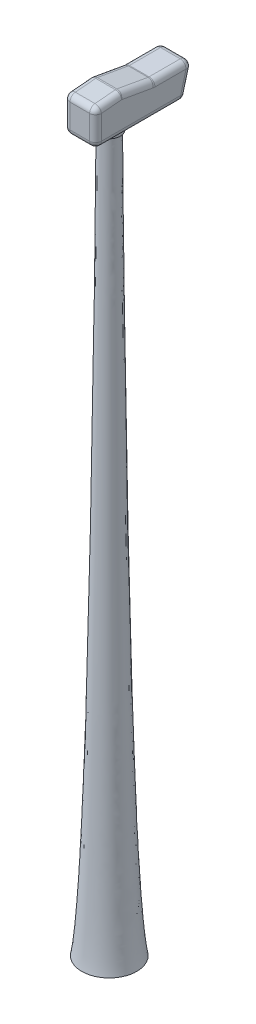
from build123d import *

# Parameters (mm, degrees)
AUFSATZ_LINEAR_AUSTRAGEN1_DEPTH      = 3840
AUFSATZ_LINEAR_AUSTRAGEN1_DEPTH_BACK = 3840
VERRUNDUNG1_R                        = 1440


with BuildPart() as part:
    # Skizze2 → Aufsatz-Linear austragen1 (new, two sides: drawn at the far end of the back side and taken through both)
    with BuildSketch(Plane(origin=(0, 0, 0), x_dir=(0, 0, -1), z_dir=(1, 0, 0)).offset(-AUFSATZ_LINEAR_AUSTRAGEN1_DEPTH_BACK)):
        Polygon((2800, -4320), (2800, 4320), (9280, 4886.926539648), (17200, 3490.416852437), (26800, 3490.416852437), (24707.205111839, -4320), align=None)
    extrude(amount=AUFSATZ_LINEAR_AUSTRAGEN1_DEPTH + AUFSATZ_LINEAR_AUSTRAGEN1_DEPTH_BACK)

    # Verrundung1
    verrundung1_edges = [part.edges().sort_by_distance(p)[0] for p in [
        (-3840, -414.791573782, -25753.60255592),
        (-3840, -4320, -13753.60255592),
        (0, -4320, -24707.205111839),
        (-3840, 3490.416852437, -22000),
        (0, 3490.416852437, -26800),
        (-3840, 4188.671696042, -13240),
        (0, 3490.416852437, -17200),
        (3840, 4188.671696042, -13240),
        (3840, 3490.416852437, -22000),
        (3840, -414.791573782, -25753.60255592),
        (3840, -4320, -13753.60255592),
        (-3840, 4603.463269824, -6040),
        (0, 4886.926539648, -9280),
        (3840, 4603.463269824, -6040),
        (-3840, 0, -2800),
        (0, 4320, -2800),
        (3840, 0, -2800),
        (0, -4320, -2800),
    ]]
    fillet(verrundung1_edges, radius=VERRUNDUNG1_R)

    # Skizze3 → Rotation1 (revolve)
    with BuildSketch(Plane(origin=(0, 0, 0), x_dir=(0, 0, -1), z_dir=(1, 0, 0))):
        with BuildLine():
            Line((10000, -2880), (7312, -2880))
            Line((7312, -2880), (7312, -5280))
            Line((7312, -5280), (7552, -5280))
            Line((7552, -5280), (7552, -4320))
            Line((7552, -4320), (7696, -4320))
            Line((7696, -4320), (7696, -5280))
            add(Edge.make_bspline(
                [(7696, -5280), (7696, -6007.773618817), (6760.658542043, -162191.98919373), (3280, -180000)],
                knots=[0, 0, 0, 0, 1, 1, 1, 1], degree=3))
            Line((3280, -180000), (10000, -180000))
            Line((10000, -180000), (10000, -2880))
        make_face()
    revolve(axis=Axis((0, 0, -10000), (0, -1, 0)))


solid = part.part
